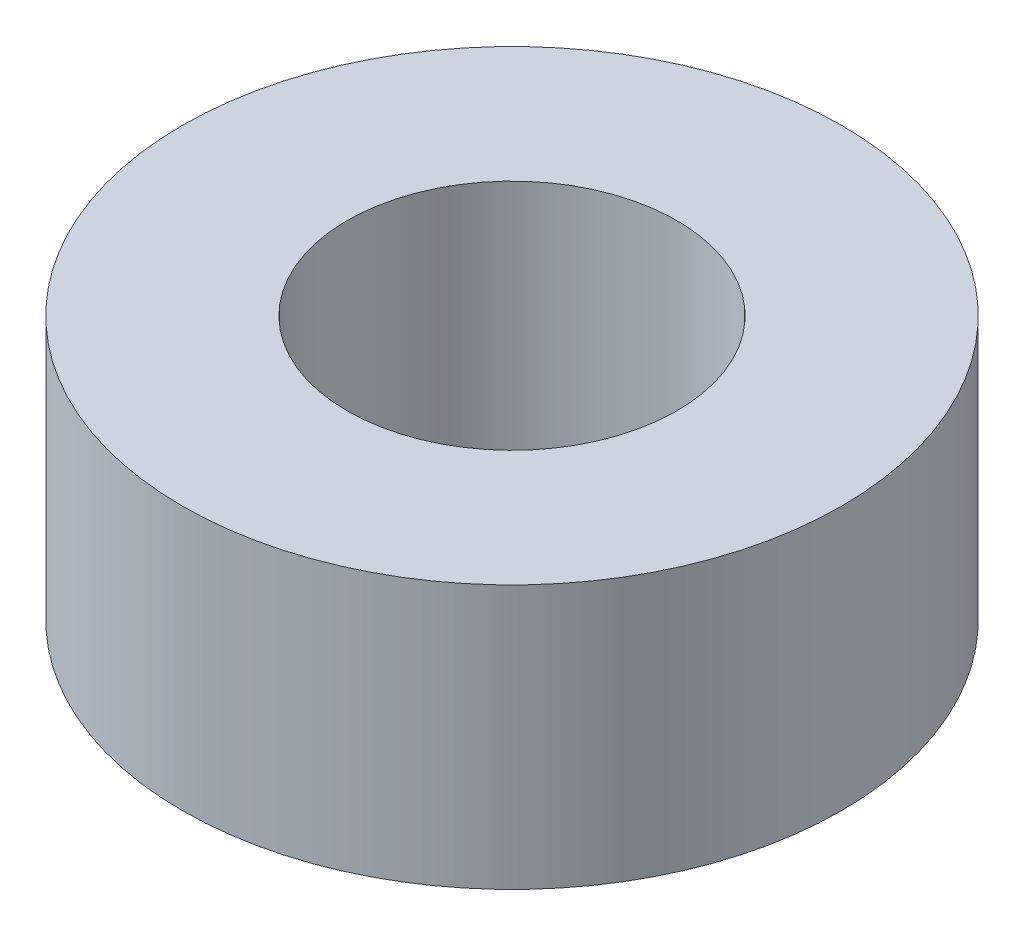
from build123d import *

# Parameters (mm, degrees)
SKETCH1_R           = 5
SKETCH1_R_2         = 2.5
BOSS_EXTRUDE1_DEPTH = 4


with BuildPart() as part:
    # Sketch1 → Boss-Extrude1 (new body)
    with BuildSketch(Plane(origin=(0, 0, 0), x_dir=(1, 0, 0), z_dir=(0, 1, 0))):
        with Locations(Location((0, 0, 0), (0, 0, 270))):
            Circle(SKETCH1_R)
        with Locations(Location((0, 0, 0), (0, 0, 270))):
            Circle(SKETCH1_R_2, mode=Mode.SUBTRACT)
    extrude(amount=BOSS_EXTRUDE1_DEPTH)


solid = part.part
